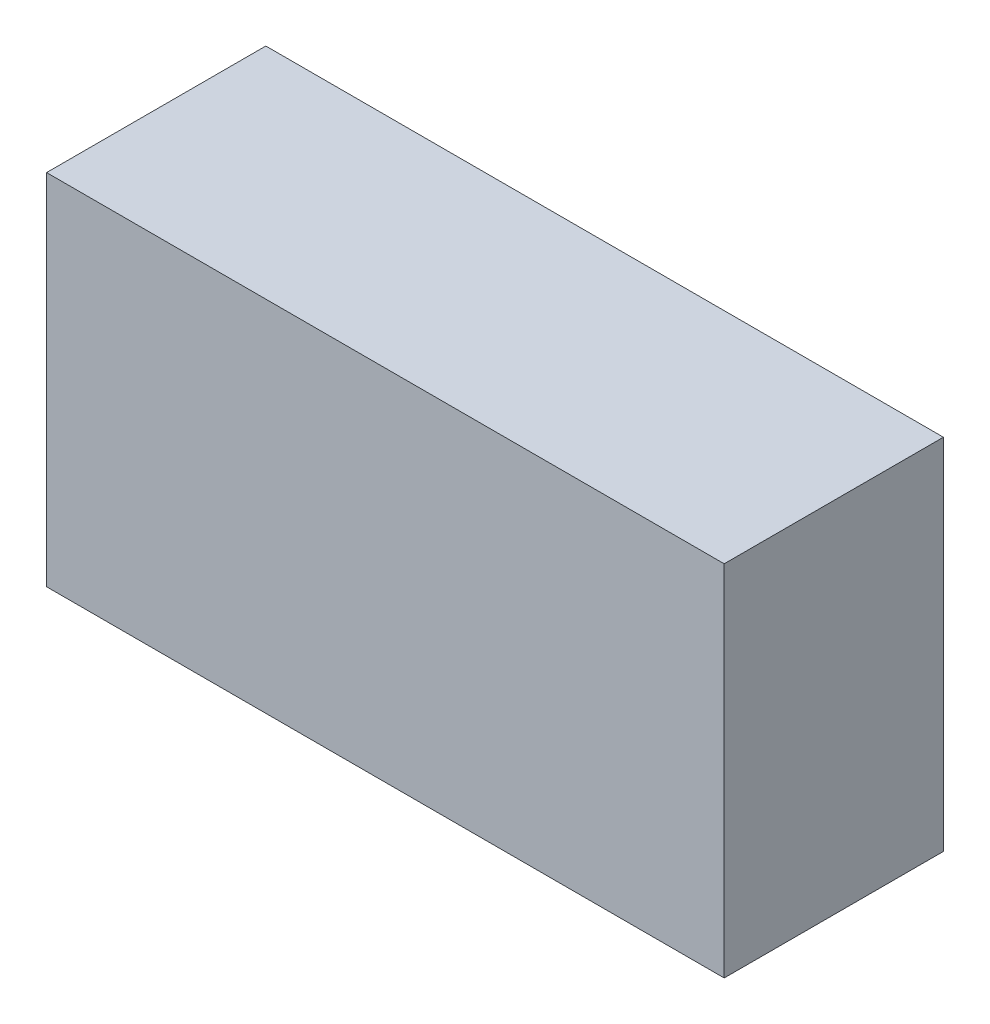
from build123d import *

# Parameters (mm, degrees)
SKETCH1_W           = 34
SKETCH1_H           = 18
BOSS_EXTRUDE1_DEPTH = 11


with BuildPart() as part:
    # Sketch1 → Boss-Extrude1 (new body)
    with BuildSketch(Plane.XY.offset(12)):
        with Locations((20, 14)):
            Rectangle(SKETCH1_W, SKETCH1_H)
    extrude(amount=BOSS_EXTRUDE1_DEPTH)


solid = part.part
